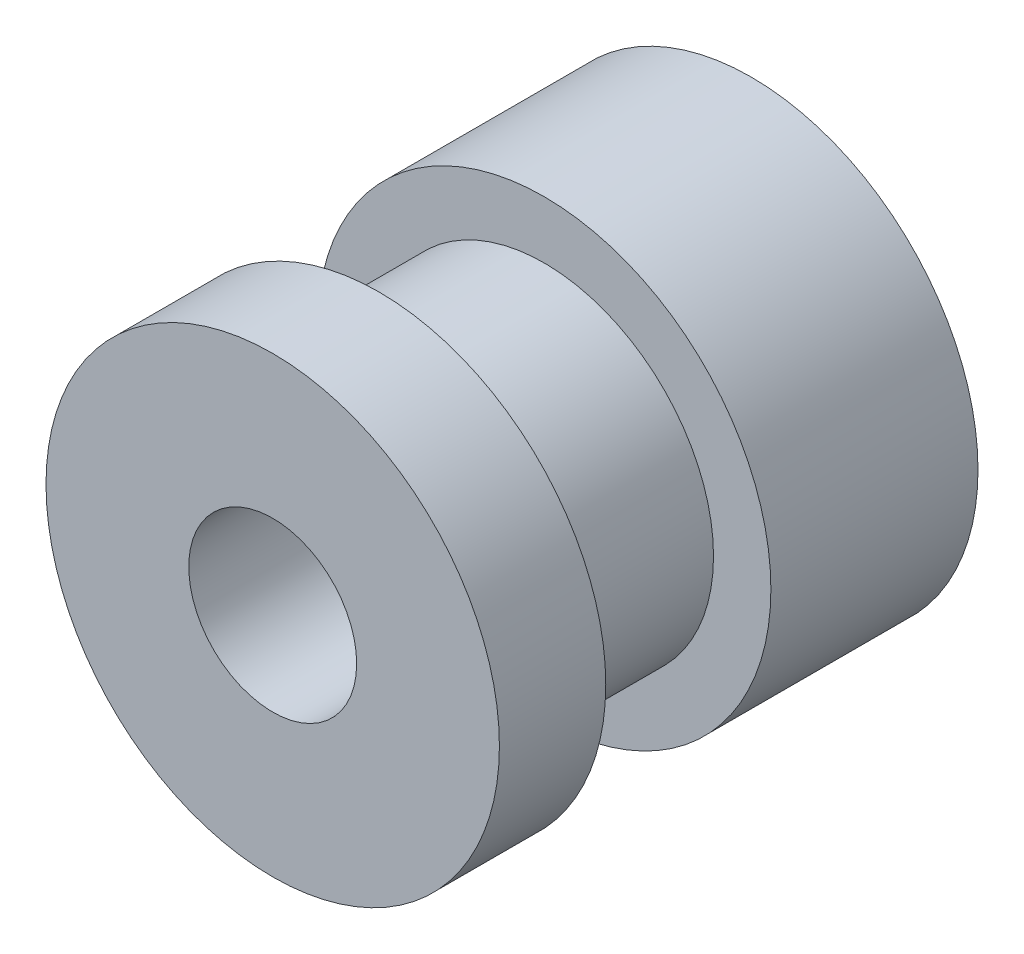
from build123d import *


with BuildPart() as part:
    # Sketch1 → Revolve1 (revolve)
    with BuildSketch(Plane(origin=(0, 0, 0), x_dir=(1, 0, 0), z_dir=(0, 1, 0)), mode=Mode.PRIVATE) as revolve1_sk:
        Polygon((-3, 0), (-8.1, 0), (-8.1, 3.8), (-6.05, 3.8), (-6.05, 9.7), (-8.1, 9.7), (-8.1, 17.1), (-3, 17.1), align=None)
    revolve(revolve1_sk.sketch.rotate(Axis((0, 0, 0), (0, 0, -1)), 180), axis=Axis((0, 0, 0), (0, 0, -1)))


solid = part.part
